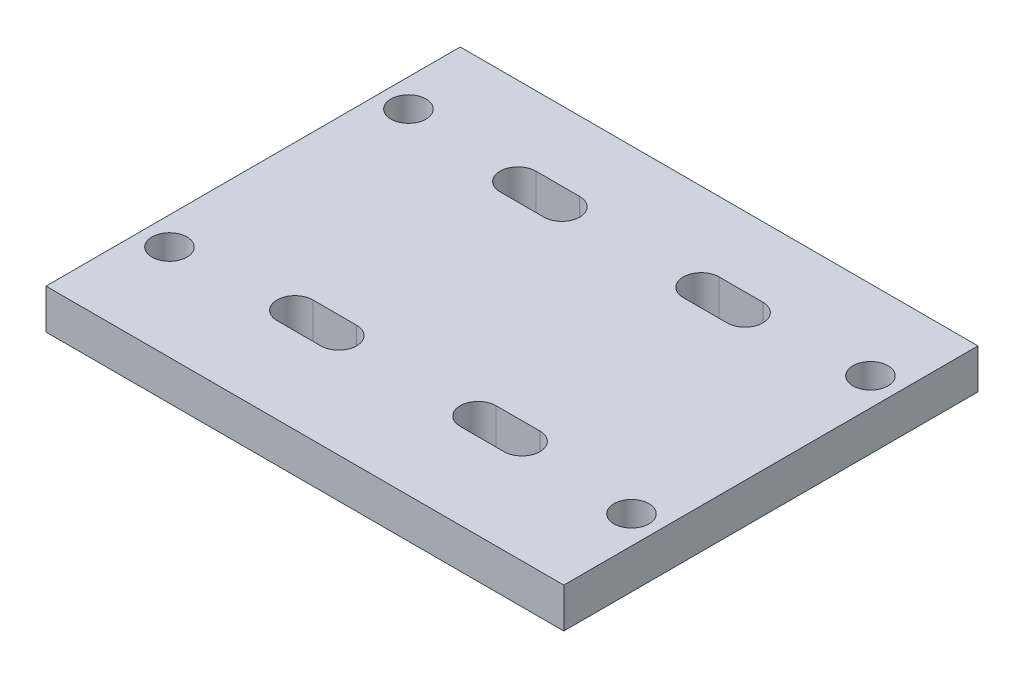
from build123d import *

# Parameters (mm, degrees)
SKIZZE1_W                       = 65
SKIZZE1_H                       = 52
SKIZZE1_R                       = 2.2
AUFSATZ_LINEAR_AUSTRAGEN1_DEPTH = 5


with BuildPart() as part:
    # Skizze1 → Aufsatz-Linear austragen1 (new body)
    with BuildSketch(Plane(origin=(0, 0, 0), x_dir=(1, 0, 0), z_dir=(0, 1, 0))):
        Rectangle(SKIZZE1_W, SKIZZE1_H)
        with Locations(Location((-29, 16, 0), (0, 0, 270))):
            Circle(SKIZZE1_R, mode=Mode.SUBTRACT)
        with Locations(Location((-29, -14, 0), (0, 0, 270))):
            Circle(SKIZZE1_R, mode=Mode.SUBTRACT)
        with Locations(Location((29, -14, 0), (0, 0, 270))):
            Circle(SKIZZE1_R, mode=Mode.SUBTRACT)
        with Locations(Location((29, 16, 0), (0, 0, 270))):
            Circle(SKIZZE1_R, mode=Mode.SUBTRACT)
        with BuildLine():
            Line((-14.25, 17.25), (-8.75, 17.25))
            ThreePointArc((-8.75, 17.25), (-6.5, 15), (-8.75, 12.75))
            Line((-8.75, 12.75), (-14.25, 12.75))
            ThreePointArc((-14.25, 12.75), (-16.5, 15), (-14.25, 17.25))
        make_face(mode=Mode.SUBTRACT)
        with BuildLine():
            Line((8.75, 17.25), (14.25, 17.25))
            ThreePointArc((14.25, 17.25), (16.5, 15), (14.25, 12.75))
            Line((14.25, 12.75), (8.75, 12.75))
            ThreePointArc((8.75, 12.75), (6.5, 15), (8.75, 17.25))
        make_face(mode=Mode.SUBTRACT)
        with BuildLine():
            Line((-14.25, -10.75), (-8.75, -10.75))
            ThreePointArc((-8.75, -10.75), (-6.5, -13), (-8.75, -15.25))
            Line((-8.75, -15.25), (-14.25, -15.25))
            ThreePointArc((-14.25, -15.25), (-16.5, -13), (-14.25, -10.75))
        make_face(mode=Mode.SUBTRACT)
        with BuildLine():
            Line((8.75, -10.75), (14.25, -10.75))
            ThreePointArc((14.25, -10.75), (16.5, -13), (14.25, -15.25))
            Line((14.25, -15.25), (8.75, -15.25))
            ThreePointArc((8.75, -15.25), (6.5, -13), (8.75, -10.75))
        make_face(mode=Mode.SUBTRACT)
    extrude(amount=AUFSATZ_LINEAR_AUSTRAGEN1_DEPTH)


solid = part.part
